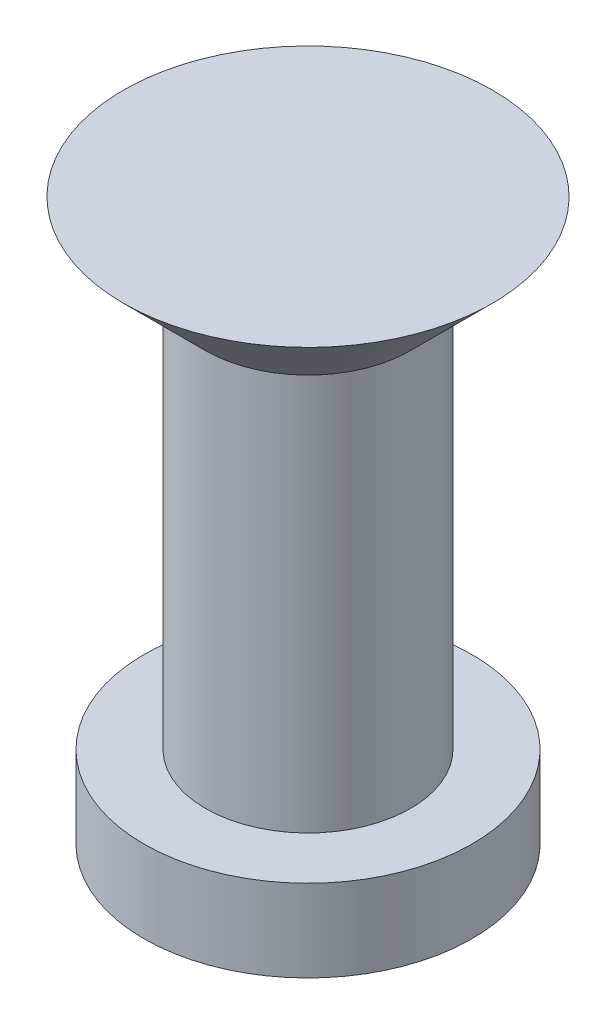
from build123d import *


with BuildPart() as part:
    # Эскиз1 → Повернуть1 (revolve)
    with BuildSketch(Plane.XY, mode=Mode.PRIVATE) as revolve_1_sk:
        Polygon((0, 8.2), (2.7, 8.2), (1.5, 7), (1.5, 1.2), (2.4, 1.2), (2.4, 0), (0, 0), align=None)
    revolve(revolve_1_sk.sketch.rotate(Axis((0, 26.718072965, 0), (0, -1, 0)), 90), axis=Axis((0, 26.718072965, 0), (0, -1, 0)))


solid = part.part
